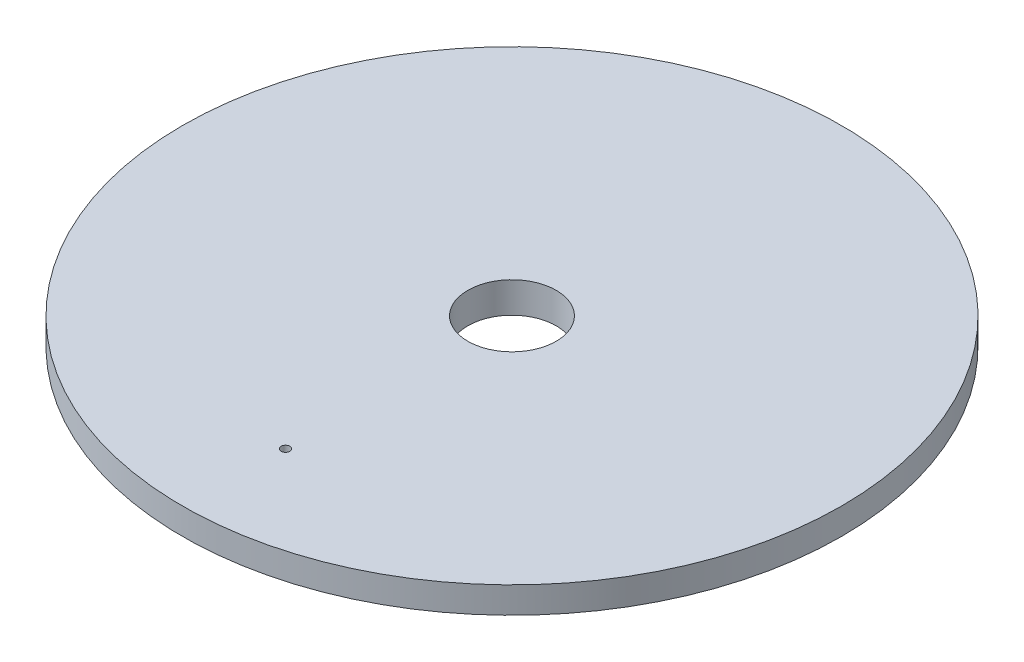
from build123d import *

# Parameters (mm, degrees)
SZKIC2_R                   = 1
WYTNIJ_WYCI_GNI_CIE1_DEPTH = 10


with BuildPart() as part:
    # Szkic1 → Obrót1 (revolve)
    with BuildSketch(Plane.XY):
        Polygon((-10.055, -7), (-10.055, 0), (-75, 0), (-75, -6), (-59.4, -6), (-59.4, -2.9), (-54, -2.9), (-54, -6), (-50, -6), (-50, -7.2), (-46.9, -7.2), (-46.9, -12.5), (-50, -12.5), (-50, -14.251552945), (-45, -14.251552945), (-43.721355564, -7), align=None)
    revolve(axis=Axis((0, 0, 0), (0, -1, 0)))

    # Szkic2 → Wytnij-wyciągnięcie1 (cut)
    with BuildSketch(Plane.XZ.offset(6)):
        with Locations((0.44346391, 51.984815166)):
            Circle(SZKIC2_R)
    extrude(amount=-WYTNIJ_WYCI_GNI_CIE1_DEPTH, mode=Mode.SUBTRACT)


solid = part.part
